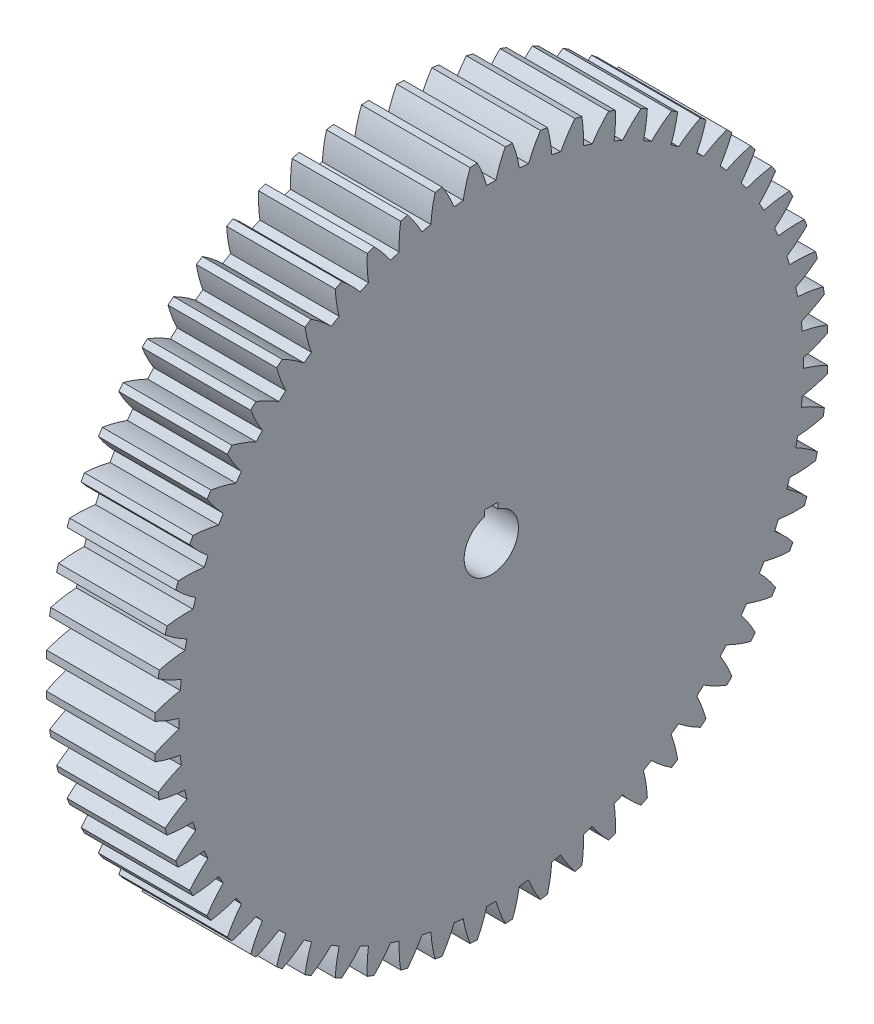
from build123d import *

# Parameters (mm, degrees)
BASPROSKE_W     = 50
BASPROSKE_H     = 155
TOOTHCUT_DEPTH  = 225.833271559
TEETHCUTS_COUNT = 60
TEETHCUTS_ANGLE = 354
BORSKE_R        = 12.5
BORE_DEPTH      = 50.0000508
KEYSKE_W        = 6.35
KEYSKE_H        = 14.88125
KEYWAY_DEPTH    = 50.0000508


with BuildPart() as part:
    # BasProSke → Base-Revolve (revolve)
    with BuildSketch(Plane(origin=(0, 0, 0), x_dir=(1, 0, 0), z_dir=(0, 1, 0)), mode=Mode.PRIVATE) as base_revolve_sk:
        with Locations((25, 77.5)):
            Rectangle(BASPROSKE_W, BASPROSKE_H)
    revolve(base_revolve_sk.sketch.rotate(Axis((-10, 0, 0), (1, 0, 0)), 180), axis=Axis((-10, 0, 0), (1, 0, 0)))

    # TooCutSke → ToothCut (cut, through all)
    with BuildSketch(Plane(origin=(0, 0, 0), x_dir=(0, 0, -1), z_dir=(1, 0, 0))):
        with BuildLine():
            ThreePointArc((2.113293984, 143.7334651), (0, 143.749), (-2.113293984, 143.7334651))
            ThreePointArc((-2.113293984, 143.7334651), (-4.012971711, 149.420886614), (-6.470843563, 154.890292881))
            ThreePointArc((-6.470843563, 154.890292881), (0, 155.0254), (6.470843563, 154.890292881))
            ThreePointArc((6.470843563, 154.890292881), (4.012971711, 149.420886614), (2.113293984, 143.7334651))
        make_face()
    toothcut = extrude(amount=TOOTHCUT_DEPTH, mode=Mode.SUBTRACT)

    # TeethCuts: ToothCut ×60 about axis
    teethcuts_axis = Axis((-10, 0, 0), (1, 0, 0))
    for i in range(1, TEETHCUTS_COUNT):
        add(toothcut.rotate(teethcuts_axis, i * TEETHCUTS_ANGLE / (TEETHCUTS_COUNT - 1)), mode=Mode.SUBTRACT)

    # BorSke → Bore (cut, symmetric)
    with BuildSketch(Plane(origin=(0, 0, 0), x_dir=(0, 0, -1), z_dir=(1, 0, 0))):
        with Locations(Location((0, 0, 0), (0, 0, 180))):
            Circle(BORSKE_R)
    extrude(amount=BORE_DEPTH, both=True, mode=Mode.SUBTRACT)

    # KeySke → Keyway (cut, symmetric)
    with BuildSketch(Plane(origin=(0, 0, 0), x_dir=(0, 0, -1), z_dir=(1, 0, 0))):
        with Locations((0, 7.440625)):
            Rectangle(KEYSKE_W, KEYSKE_H)
    extrude(amount=KEYWAY_DEPTH, both=True, mode=Mode.SUBTRACT)


solid = part.part
